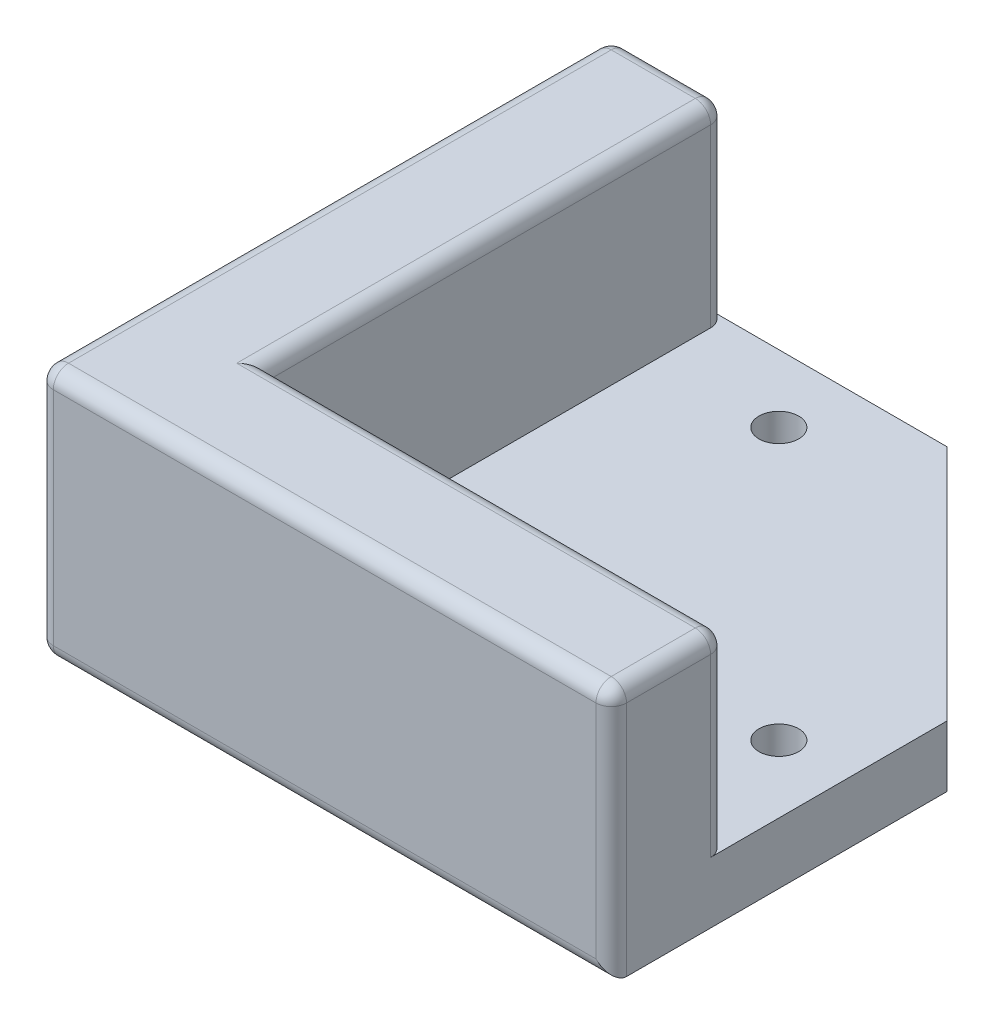
from build123d import *

# Parameters (mm, degrees)
BOSS_EXTRUDE1_DEPTH      = 2.54
SKETCH2_W                = 9.525
SKETCH2_H                = 38.1
BOSS_EXTRUDE2_DEPTH      = 15.875
BOSS_EXTRUDE3_DEPTH      = 5.08
M3_CLEARANCE_HOLE1_D     = 3.3
M3_CLEARANCE_HOLE1_DEPTH = 12.7
M3_CLEARANCE_HOLE1_TIP   = 0.991420021
SKETCH7_W                = 35.71875
SKETCH7_H                = 2.38125
CUT_EXTRUDE1_DEPTH       = 2.54
FILLET1_R                = 1.27


with BuildPart() as part:
    # Sketch1 → Boss-Extrude1 (new body)
    with BuildSketch(Plane(origin=(0, 0, 0), x_dir=(1, 0, 0), z_dir=(0, 1, 0))):
        Polygon((0, 0), (38.1, 0), (38.1, 2.38125), (2.38125, 2.38125), (2.38125, 38.1), (0, 38.1), align=None)
    extrude(amount=BOSS_EXTRUDE1_DEPTH)

    # Sketch2 → Boss-Extrude2 (add)
    with BuildSketch(Plane(origin=(0, 2.54, 0), x_dir=(1, 0, 0), z_dir=(0, 1, 0))):
        with Locations((-4.7625, 19.05)):
            Rectangle(SKETCH2_W, SKETCH2_H)
        Polygon((0, 0), (-9.525, 0), (-9.525, -9.525), (38.1, -9.525), (38.1, 0), align=None)
    extrude(amount=-BOSS_EXTRUDE2_DEPTH)

    # Sketch3 → Boss-Extrude3 (add)
    with BuildSketch(Plane(origin=(0, -13.335, 0), x_dir=(-1, 0, 0), z_dir=(0, -1, 0))):
        Polygon((9.525, -9.525), (-38.1, -9.525), (-38.1, 18.373079092), (-18.373079092, 38.1), (9.525, 38.1), align=None)
    extrude(amount=BOSS_EXTRUDE3_DEPTH)

    # M3 Clearance Hole1
    with Locations(Plane(origin=(0, -18.415, 0), x_dir=(-1, 0, 0), z_dir=(0, -1, 0))):
        with Locations((-10, 32.5), (-32.5, 10)):
            Hole(M3_CLEARANCE_HOLE1_D / 2, depth=M3_CLEARANCE_HOLE1_DEPTH)
            with Locations((0, 0, -(M3_CLEARANCE_HOLE1_DEPTH + M3_CLEARANCE_HOLE1_TIP / 2))):  # 118° drill point
                Cone(0, M3_CLEARANCE_HOLE1_D / 2, M3_CLEARANCE_HOLE1_TIP, mode=Mode.SUBTRACT)

    # Sketch7 → Cut-Extrude1 (cut)
    with BuildSketch(Plane(origin=(0, 2.54, 0), x_dir=(1, 0, 0), z_dir=(0, 1, 0))):
        with Locations((20.240625, 1.190625)):
            Rectangle(SKETCH7_W, SKETCH7_H)
        Polygon((0, 0), (2.38125, 0), (2.38125, 2.38125), (2.38125, 38.1), (0, 38.1), align=None)
    extrude(amount=-CUT_EXTRUDE1_DEPTH, mode=Mode.SUBTRACT)

    # Fillet1
    fillet1_edges = [part.edges().sort_by_distance(p)[0] for p in [
        (38.1, 2.54, 4.7625),
        (0, -5.3975, -38.1),
        (-9.525, -7.9375, -38.1),
        (38.1, -5.3975, 0),
        (14.2875, 2.54, 9.525),
        (38.1, -7.9375, 9.525),
        (-9.525, -7.9375, 9.525),
        (-9.525, 2.54, -14.2875),
        (-9.525, -18.415, -14.2875),
        (14.2875, -18.415, 9.525),
        (-4.7625, 2.54, -38.1),
        (0, 2.54, -19.05),
        (19.05, 2.54, 0),
    ]]
    fillet(fillet1_edges, radius=FILLET1_R)


solid = part.part
